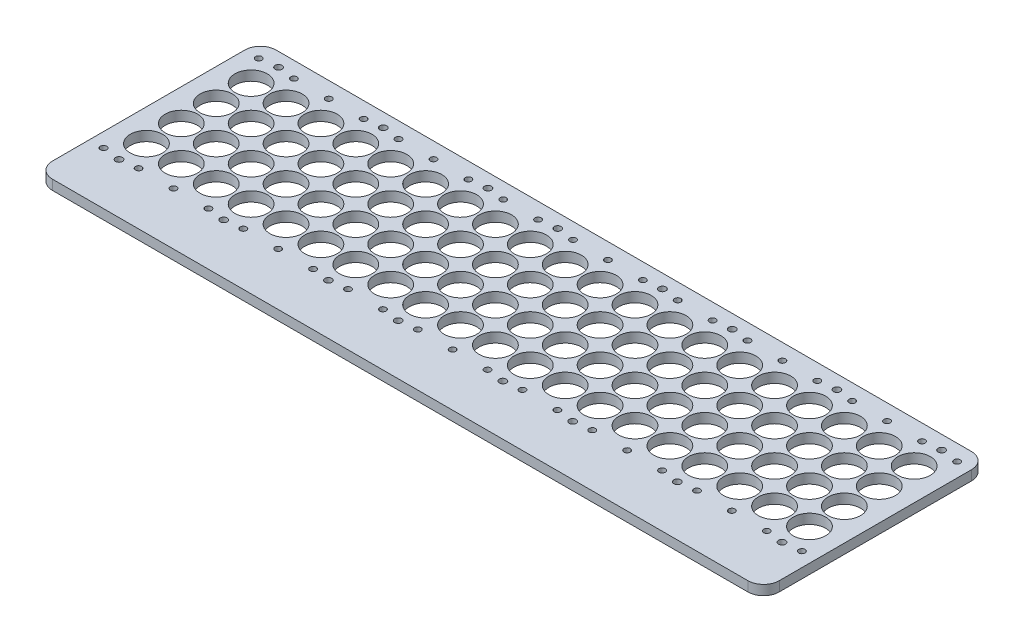
from build123d import *

# Parameters (mm, degrees)
SKETCH2_W            = 460.500324639
SKETCH2_H            = 122.781446958
SKETCH2_R            = 10.5
SKETCH2_R_2          = 2.0447
SKETCH2_R_3          = 1
BOSS_EXTRUDE3_DEPTH  = 6.35
M4_CLEARANCE_HOLE1_D = 4.5
SKETCH12_W           = 5.08
SKETCH12_H           = 122.781446958
SKETCH12_W_2         = 5.253675361
BOSS_EXTRUDE4_DEPTH  = 6.35
SKETCH14_R           = 4.699999998
SKETCH14_R_2         = 2.0447
CUT_EXTRUDE1_DEPTH   = 461.029864523
SKETCH16_W           = 470.834
SKETCH16_H           = 22.10816
BOSS_EXTRUDE5_DEPTH  = 6.35
FILLET2_R            = 10.16
FILLET3_R            = 10.16


with BuildPart() as part:
    # Sketch2 → Boss-Extrude3 (new body)
    with BuildSketch(Plane(origin=(0, 0, 0), x_dir=(1, 0, 0), z_dir=(0, 1, 0))):
        with Locations((214.67016232, 33.110723479)):
            Rectangle(SKETCH2_W, SKETCH2_H)
        with Locations(Location((0, 0, 0), (0, 0, 270))):
            Circle(SKETCH2_R, mode=Mode.SUBTRACT)
        with Locations(Location((22.606, 0, 0), (0, 0, 270))):
            Circle(SKETCH2_R, mode=Mode.SUBTRACT)
        with Locations(Location((45.212, 0, 0), (0, 0, 270))):
            Circle(SKETCH2_R, mode=Mode.SUBTRACT)
        with Locations(Location((67.818, 0, 0), (0, 0, 270))):
            Circle(SKETCH2_R, mode=Mode.SUBTRACT)
        with Locations(Location((90.424, 0, 0), (0, 0, 270))):
            Circle(SKETCH2_R, mode=Mode.SUBTRACT)
        with Locations(Location((113.03, 0, 0), (0, 0, 270))):
            Circle(SKETCH2_R, mode=Mode.SUBTRACT)
        with Locations(Location((135.636, 0, 0), (0, 0, 270))):
            Circle(SKETCH2_R, mode=Mode.SUBTRACT)
        with Locations(Location((158.242, 0, 0), (0, 0, 270))):
            Circle(SKETCH2_R, mode=Mode.SUBTRACT)
        with Locations(Location((180.848, 0, 0), (0, 0, 270))):
            Circle(SKETCH2_R, mode=Mode.SUBTRACT)
        with Locations(Location((203.454, 0, 0), (0, 0, 270))):
            Circle(SKETCH2_R, mode=Mode.SUBTRACT)
        with Locations(Location((226.06, 0, 0), (0, 0, 270))):
            Circle(SKETCH2_R, mode=Mode.SUBTRACT)
        with Locations(Location((248.666, 0, 0), (0, 0, 270))):
            Circle(SKETCH2_R, mode=Mode.SUBTRACT)
        with Locations(Location((271.272, 0, 0), (0, 0, 270))):
            Circle(SKETCH2_R, mode=Mode.SUBTRACT)
        with Locations(Location((293.878, 0, 0), (0, 0, 270))):
            Circle(SKETCH2_R, mode=Mode.SUBTRACT)
        with Locations(Location((316.484, 0, 0), (0, 0, 270))):
            Circle(SKETCH2_R, mode=Mode.SUBTRACT)
        with Locations(Location((339.09, 0, 0), (0, 0, 270))):
            Circle(SKETCH2_R, mode=Mode.SUBTRACT)
        with Locations(Location((22.606, 22.606, 0), (0, 0, 270))):
            Circle(SKETCH2_R, mode=Mode.SUBTRACT)
        with Locations(Location((45.212, 22.606, 0), (0, 0, 270))):
            Circle(SKETCH2_R, mode=Mode.SUBTRACT)
        with Locations(Location((67.818, 22.606, 0), (0, 0, 270))):
            Circle(SKETCH2_R, mode=Mode.SUBTRACT)
        with Locations(Location((90.424, 22.606, 0), (0, 0, 270))):
            Circle(SKETCH2_R, mode=Mode.SUBTRACT)
        with Locations(Location((113.03, 22.606, 0), (0, 0, 270))):
            Circle(SKETCH2_R, mode=Mode.SUBTRACT)
        with Locations(Location((135.636, 22.606, 0), (0, 0, 270))):
            Circle(SKETCH2_R, mode=Mode.SUBTRACT)
        with Locations(Location((158.242, 22.606, 0), (0, 0, 270))):
            Circle(SKETCH2_R, mode=Mode.SUBTRACT)
        with Locations(Location((180.848, 22.606, 0), (0, 0, 270))):
            Circle(SKETCH2_R, mode=Mode.SUBTRACT)
        with Locations(Location((203.454, 22.606, 0), (0, 0, 270))):
            Circle(SKETCH2_R, mode=Mode.SUBTRACT)
        with Locations(Location((226.06, 22.606, 0), (0, 0, 270))):
            Circle(SKETCH2_R, mode=Mode.SUBTRACT)
        with Locations(Location((248.666, 22.606, 0), (0, 0, 270))):
            Circle(SKETCH2_R, mode=Mode.SUBTRACT)
        with Locations(Location((271.272, 22.606, 0), (0, 0, 270))):
            Circle(SKETCH2_R, mode=Mode.SUBTRACT)
        with Locations(Location((293.878, 22.606, 0), (0, 0, 270))):
            Circle(SKETCH2_R, mode=Mode.SUBTRACT)
        with Locations(Location((316.484, 22.606, 0), (0, 0, 270))):
            Circle(SKETCH2_R, mode=Mode.SUBTRACT)
        with Locations(Location((339.09, 22.606, 0), (0, 0, 270))):
            Circle(SKETCH2_R, mode=Mode.SUBTRACT)
        with Locations(Location((22.606, 45.212, 0), (0, 0, 270))):
            Circle(SKETCH2_R, mode=Mode.SUBTRACT)
        with Locations(Location((45.212, 45.212, 0), (0, 0, 270))):
            Circle(SKETCH2_R, mode=Mode.SUBTRACT)
        with Locations(Location((67.818, 45.212, 0), (0, 0, 270))):
            Circle(SKETCH2_R, mode=Mode.SUBTRACT)
        with Locations(Location((90.424, 45.212, 0), (0, 0, 270))):
            Circle(SKETCH2_R, mode=Mode.SUBTRACT)
        with Locations(Location((113.03, 45.212, 0), (0, 0, 270))):
            Circle(SKETCH2_R, mode=Mode.SUBTRACT)
        with Locations(Location((135.636, 45.212, 0), (0, 0, 270))):
            Circle(SKETCH2_R, mode=Mode.SUBTRACT)
        with Locations(Location((158.242, 45.212, 0), (0, 0, 270))):
            Circle(SKETCH2_R, mode=Mode.SUBTRACT)
        with Locations(Location((180.848, 45.212, 0), (0, 0, 270))):
            Circle(SKETCH2_R, mode=Mode.SUBTRACT)
        with Locations(Location((203.454, 45.212, 0), (0, 0, 270))):
            Circle(SKETCH2_R, mode=Mode.SUBTRACT)
        with Locations(Location((226.06, 45.212, 0), (0, 0, 270))):
            Circle(SKETCH2_R, mode=Mode.SUBTRACT)
        with Locations(Location((248.666, 45.212, 0), (0, 0, 270))):
            Circle(SKETCH2_R, mode=Mode.SUBTRACT)
        with Locations(Location((271.272, 45.212, 0), (0, 0, 270))):
            Circle(SKETCH2_R, mode=Mode.SUBTRACT)
        with Locations(Location((293.878, 45.212, 0), (0, 0, 270))):
            Circle(SKETCH2_R, mode=Mode.SUBTRACT)
        with Locations(Location((316.484, 45.212, 0), (0, 0, 270))):
            Circle(SKETCH2_R, mode=Mode.SUBTRACT)
        with Locations(Location((339.09, 45.212, 0), (0, 0, 270))):
            Circle(SKETCH2_R, mode=Mode.SUBTRACT)
        with Locations(Location((22.606, 67.818, 0), (0, 0, 270))):
            Circle(SKETCH2_R, mode=Mode.SUBTRACT)
        with Locations(Location((45.212, 67.818, 0), (0, 0, 270))):
            Circle(SKETCH2_R, mode=Mode.SUBTRACT)
        with Locations(Location((67.818, 67.818, 0), (0, 0, 270))):
            Circle(SKETCH2_R, mode=Mode.SUBTRACT)
        with Locations(Location((90.424, 67.818, 0), (0, 0, 270))):
            Circle(SKETCH2_R, mode=Mode.SUBTRACT)
        with Locations(Location((113.03, 67.818, 0), (0, 0, 270))):
            Circle(SKETCH2_R, mode=Mode.SUBTRACT)
        with Locations(Location((135.636, 67.818, 0), (0, 0, 270))):
            Circle(SKETCH2_R, mode=Mode.SUBTRACT)
        with Locations(Location((158.242, 67.818, 0), (0, 0, 270))):
            Circle(SKETCH2_R, mode=Mode.SUBTRACT)
        with Locations(Location((180.848, 67.818, 0), (0, 0, 270))):
            Circle(SKETCH2_R, mode=Mode.SUBTRACT)
        with Locations(Location((203.454, 67.818, 0), (0, 0, 270))):
            Circle(SKETCH2_R, mode=Mode.SUBTRACT)
        with Locations(Location((226.06, 67.818, 0), (0, 0, 270))):
            Circle(SKETCH2_R, mode=Mode.SUBTRACT)
        with Locations(Location((248.666, 67.818, 0), (0, 0, 270))):
            Circle(SKETCH2_R, mode=Mode.SUBTRACT)
        with Locations(Location((271.272, 67.818, 0), (0, 0, 270))):
            Circle(SKETCH2_R, mode=Mode.SUBTRACT)
        with Locations(Location((293.878, 67.818, 0), (0, 0, 270))):
            Circle(SKETCH2_R, mode=Mode.SUBTRACT)
        with Locations(Location((316.484, 67.818, 0), (0, 0, 270))):
            Circle(SKETCH2_R, mode=Mode.SUBTRACT)
        with Locations(Location((339.09, 67.818, 0), (0, 0, 270))):
            Circle(SKETCH2_R, mode=Mode.SUBTRACT)
        with Locations(Location((0, 22.606, 0), (0, 0, 270))):
            Circle(SKETCH2_R, mode=Mode.SUBTRACT)
        with Locations(Location((0, 45.212, 0), (0, 0, 270))):
            Circle(SKETCH2_R, mode=Mode.SUBTRACT)
        with Locations(Location((0, 67.818, 0), (0, 0, 270))):
            Circle(SKETCH2_R, mode=Mode.SUBTRACT)
        with Locations(Location((361.696, 0, 0), (0, 0, 270))):
            Circle(SKETCH2_R, mode=Mode.SUBTRACT)
        with Locations(Location((384.302, 0, 0), (0, 0, 270))):
            Circle(SKETCH2_R, mode=Mode.SUBTRACT)
        with Locations(Location((406.908, 0, 0), (0, 0, 270))):
            Circle(SKETCH2_R, mode=Mode.SUBTRACT)
        with Locations(Location((429.514, 0, 0), (0, 0, 270))):
            Circle(SKETCH2_R, mode=Mode.SUBTRACT)
        with Locations(Location((361.696, 22.606, 0), (0, 0, 270))):
            Circle(SKETCH2_R, mode=Mode.SUBTRACT)
        with Locations(Location((384.302, 22.606, 0), (0, 0, 270))):
            Circle(SKETCH2_R, mode=Mode.SUBTRACT)
        with Locations(Location((406.908, 22.606, 0), (0, 0, 270))):
            Circle(SKETCH2_R, mode=Mode.SUBTRACT)
        with Locations(Location((429.514, 22.606, 0), (0, 0, 270))):
            Circle(SKETCH2_R, mode=Mode.SUBTRACT)
        with Locations(Location((361.696, 45.212, 0), (0, 0, 270))):
            Circle(SKETCH2_R, mode=Mode.SUBTRACT)
        with Locations(Location((384.302, 45.212, 0), (0, 0, 270))):
            Circle(SKETCH2_R, mode=Mode.SUBTRACT)
        with Locations(Location((406.908, 45.212, 0), (0, 0, 270))):
            Circle(SKETCH2_R, mode=Mode.SUBTRACT)
        with Locations(Location((429.514, 45.212, 0), (0, 0, 270))):
            Circle(SKETCH2_R, mode=Mode.SUBTRACT)
        with Locations(Location((361.696, 67.818, 0), (0, 0, 270))):
            Circle(SKETCH2_R, mode=Mode.SUBTRACT)
        with Locations(Location((384.302, 67.818, 0), (0, 0, 270))):
            Circle(SKETCH2_R, mode=Mode.SUBTRACT)
        with Locations(Location((406.908, 67.818, 0), (0, 0, 270))):
            Circle(SKETCH2_R, mode=Mode.SUBTRACT)
        with Locations(Location((429.514, 67.818, 0), (0, 0, 270))):
            Circle(SKETCH2_R, mode=Mode.SUBTRACT)
        with Locations(Location((11.303, 84.185400082, 0), (0, 0, 270))):
            Circle(SKETCH2_R_2, mode=Mode.SUBTRACT)
        with Locations(Location((33.909, 84.185400082, 0), (0, 0, 270))):
            Circle(SKETCH2_R_2, mode=Mode.SUBTRACT)
        with Locations(Location((56.515, 84.185400082, 0), (0, 0, 270))):
            Circle(SKETCH2_R_2, mode=Mode.SUBTRACT)
        with Locations(Location((79.121, 84.185400082, 0), (0, 0, 270))):
            Circle(SKETCH2_R_2, mode=Mode.SUBTRACT)
        with Locations(Location((101.727, 84.185400082, 0), (0, 0, 270))):
            Circle(SKETCH2_R_2, mode=Mode.SUBTRACT)
        with Locations(Location((124.333, 84.185400082, 0), (0, 0, 270))):
            Circle(SKETCH2_R_2, mode=Mode.SUBTRACT)
        with Locations(Location((146.939, 84.185400082, 0), (0, 0, 270))):
            Circle(SKETCH2_R_2, mode=Mode.SUBTRACT)
        with Locations(Location((169.545, 84.185400082, 0), (0, 0, 270))):
            Circle(SKETCH2_R_2, mode=Mode.SUBTRACT)
        with Locations(Location((192.151, 84.185400082, 0), (0, 0, 270))):
            Circle(SKETCH2_R_2, mode=Mode.SUBTRACT)
        with Locations(Location((214.757, 84.185400082, 0), (0, 0, 270))):
            Circle(SKETCH2_R_2, mode=Mode.SUBTRACT)
        with Locations(Location((237.363, 84.185400082, 0), (0, 0, 270))):
            Circle(SKETCH2_R_2, mode=Mode.SUBTRACT)
        with Locations(Location((259.969, 84.185400082, 0), (0, 0, 270))):
            Circle(SKETCH2_R_2, mode=Mode.SUBTRACT)
        with Locations(Location((282.575, 84.185400082, 0), (0, 0, 270))):
            Circle(SKETCH2_R_2, mode=Mode.SUBTRACT)
        with Locations(Location((305.181, 84.185400082, 0), (0, 0, 270))):
            Circle(SKETCH2_R_2, mode=Mode.SUBTRACT)
        with Locations(Location((327.787, 84.185400082, 0), (0, 0, 270))):
            Circle(SKETCH2_R_2, mode=Mode.SUBTRACT)
        with Locations(Location((350.393, 84.185400082, 0), (0, 0, 270))):
            Circle(SKETCH2_R_2, mode=Mode.SUBTRACT)
        with Locations(Location((372.999, 84.185400082, 0), (0, 0, 270))):
            Circle(SKETCH2_R_2, mode=Mode.SUBTRACT)
        with Locations(Location((395.605, 84.185400082, 0), (0, 0, 270))):
            Circle(SKETCH2_R_2, mode=Mode.SUBTRACT)
        with Locations(Location((418.211, 84.185400082, 0), (0, 0, 270))):
            Circle(SKETCH2_R_2, mode=Mode.SUBTRACT)
        with Locations(Location((418.211, -16.367400082, 0), (0, 0, 270))):
            Circle(SKETCH2_R_2, mode=Mode.SUBTRACT)
        with Locations(Location((395.605, -16.367400082, 0), (0, 0, 270))):
            Circle(SKETCH2_R_2, mode=Mode.SUBTRACT)
        with Locations(Location((372.999, -16.367400082, 0), (0, 0, 270))):
            Circle(SKETCH2_R_2, mode=Mode.SUBTRACT)
        with Locations(Location((350.393, -16.367400082, 0), (0, 0, 270))):
            Circle(SKETCH2_R_2, mode=Mode.SUBTRACT)
        with Locations(Location((327.787, -16.367400082, 0), (0, 0, 270))):
            Circle(SKETCH2_R_2, mode=Mode.SUBTRACT)
        with Locations(Location((305.181, -16.367400082, 0), (0, 0, 270))):
            Circle(SKETCH2_R_2, mode=Mode.SUBTRACT)
        with Locations(Location((282.575, -16.367400082, 0), (0, 0, 270))):
            Circle(SKETCH2_R_2, mode=Mode.SUBTRACT)
        with Locations(Location((259.969, -16.367400082, 0), (0, 0, 270))):
            Circle(SKETCH2_R_2, mode=Mode.SUBTRACT)
        with Locations(Location((237.363, -16.367400082, 0), (0, 0, 270))):
            Circle(SKETCH2_R_2, mode=Mode.SUBTRACT)
        with Locations(Location((214.757, -16.367400082, 0), (0, 0, 270))):
            Circle(SKETCH2_R_2, mode=Mode.SUBTRACT)
        with Locations(Location((192.151, -16.367400082, 0), (0, 0, 270))):
            Circle(SKETCH2_R_2, mode=Mode.SUBTRACT)
        with Locations(Location((169.545, -16.367400082, 0), (0, 0, 270))):
            Circle(SKETCH2_R_2, mode=Mode.SUBTRACT)
        with Locations(Location((146.939, -16.367400082, 0), (0, 0, 270))):
            Circle(SKETCH2_R_2, mode=Mode.SUBTRACT)
        with Locations(Location((124.333, -16.367400082, 0), (0, 0, 270))):
            Circle(SKETCH2_R_2, mode=Mode.SUBTRACT)
        with Locations(Location((101.727, -16.367400082, 0), (0, 0, 270))):
            Circle(SKETCH2_R_2, mode=Mode.SUBTRACT)
        with Locations(Location((79.121, -16.367400082, 0), (0, 0, 270))):
            Circle(SKETCH2_R_2, mode=Mode.SUBTRACT)
        with Locations(Location((56.515, -16.367400082, 0), (0, 0, 270))):
            Circle(SKETCH2_R_2, mode=Mode.SUBTRACT)
        with Locations(Location((33.909, -16.367400082, 0), (0, 0, 270))):
            Circle(SKETCH2_R_2, mode=Mode.SUBTRACT)
        with Locations(Location((11.303, -16.367400082, 0), (0, 0, 270))):
            Circle(SKETCH2_R_2, mode=Mode.SUBTRACT)
        with Locations(Location((0, -17.77, 0), (0, 0, 270))):
            Circle(SKETCH2_R_3, mode=Mode.SUBTRACT)
        with Locations(Location((67.818, -17.77, 0), (0, 0, 270))):
            Circle(SKETCH2_R_3, mode=Mode.SUBTRACT)
        with Locations(Location((135.636, -17.77, 0), (0, 0, 270))):
            Circle(SKETCH2_R_3, mode=Mode.SUBTRACT)
        with Locations(Location((180.848, -17.77, 0), (0, 0, 270))):
            Circle(SKETCH2_R_3, mode=Mode.SUBTRACT)
        with Locations(Location((248.666, -17.77, 0), (0, 0, 270))):
            Circle(SKETCH2_R_3, mode=Mode.SUBTRACT)
        with Locations(Location((293.878, -17.77, 0), (0, 0, 270))):
            Circle(SKETCH2_R_3, mode=Mode.SUBTRACT)
        with Locations(Location((361.696, -17.77, 0), (0, 0, 270))):
            Circle(SKETCH2_R_3, mode=Mode.SUBTRACT)
        with Locations(Location((429.514, -17.77, 0), (0, 0, 270))):
            Circle(SKETCH2_R_3, mode=Mode.SUBTRACT)
        with Locations(Location((429.514, 85.588, 0), (0, 0, 270))):
            Circle(SKETCH2_R_3, mode=Mode.SUBTRACT)
        with Locations(Location((361.696, 85.588, 0), (0, 0, 270))):
            Circle(SKETCH2_R_3, mode=Mode.SUBTRACT)
        with Locations(Location((293.878, 85.588, 0), (0, 0, 270))):
            Circle(SKETCH2_R_3, mode=Mode.SUBTRACT)
        with Locations(Location((248.666, 85.588, 0), (0, 0, 270))):
            Circle(SKETCH2_R_3, mode=Mode.SUBTRACT)
        with Locations(Location((180.848, 85.588, 0), (0, 0, 270))):
            Circle(SKETCH2_R_3, mode=Mode.SUBTRACT)
        with Locations(Location((135.636, 85.588, 0), (0, 0, 270))):
            Circle(SKETCH2_R_3, mode=Mode.SUBTRACT)
        with Locations(Location((67.818, 85.588, 0), (0, 0, 270))):
            Circle(SKETCH2_R_3, mode=Mode.SUBTRACT)
        with Locations(Location((0, 85.588, 0), (0, 0, 270))):
            Circle(SKETCH2_R_3, mode=Mode.SUBTRACT)
    extrude(amount=BOSS_EXTRUDE3_DEPTH)

    # M4 Clearance Hole1 (through all)
    with Locations(Plane(origin=(0, 6.35, 0), x_dir=(1, 0, 0), z_dir=(0, 1, 0))):
        with Locations((0, -17.77), (67.818, -17.77), (135.636, -17.77), (180.848, -17.77), (248.666, -17.77), (293.878, -17.77), (361.696, -17.77), (429.514, -17.77), (429.514, 85.588), (361.696, 85.588), (293.878, 85.588), (248.666, 85.588), (180.848, 85.588), (67.818, 85.588), (0, 85.588), (135.636, 85.588)):
            Hole(M4_CLEARANCE_HOLE1_D / 2)

    # Sketch12 → Boss-Extrude4 (add)
    with BuildSketch(Plane(origin=(0, 6.35, 0), x_dir=(1, 0, 0), z_dir=(0, 1, 0))):
        with Locations((-18.12, 33.110723479)):
            Rectangle(SKETCH12_W, SKETCH12_H)
        with Locations((447.547162319, 33.110723479)):
            Rectangle(SKETCH12_W_2, SKETCH12_H)
    extrude(amount=-BOSS_EXTRUDE4_DEPTH)

    # Sketch14 → Cut-Extrude1 (cut, through all)
    with BuildSketch(Plane(origin=(0, 6.35, 0), x_dir=(1, 0, 0), z_dir=(0, 1, 0))):
        Circle(SKETCH14_R)
        with Locations(Location((-11.449999998, -16.367400082, 0), (0, 0, 270))):
            Circle(SKETCH14_R_2)
        with Locations(Location((-11.449999998, 84.185400082, 0), (0, 0, 270))):
            Circle(SKETCH14_R_2)
        with Locations(Location((440.963999998, -16.367400082, 0), (0, 0, 90))):
            Circle(SKETCH14_R_2)
        with Locations(Location((440.963999998, 84.185400082, 0), (0, 0, 90))):
            Circle(SKETCH14_R_2)
    extrude(amount=-CUT_EXTRUDE1_DEPTH, mode=Mode.SUBTRACT)

    # Sketch16 → Boss-Extrude5 (add)
    with BuildSketch(Plane(origin=(0, 6.35, 0), x_dir=(1, 0, 0), z_dir=(0, 1, 0))):
        with Locations((214.757, -39.33408)):
            Rectangle(SKETCH16_W, SKETCH16_H)
    extrude(amount=-BOSS_EXTRUDE5_DEPTH)

    # Fillet2
    fillet2_edges = [part.edges().sort_by_distance(p)[0] for p in [
        (450.174, 3.175, -94.501446958),
        (-20.66, 3.175, -94.501446958),
    ]]
    fillet(fillet2_edges, radius=FILLET2_R)

    # Fillet3
    fillet3_edges = [part.edges().sort_by_distance(p)[0] for p in [
        (-20.66, 3.175, 50.38816),
        (450.174, 3.175, 50.38816),
    ]]
    fillet(fillet3_edges, radius=FILLET3_R)


solid = part.part
